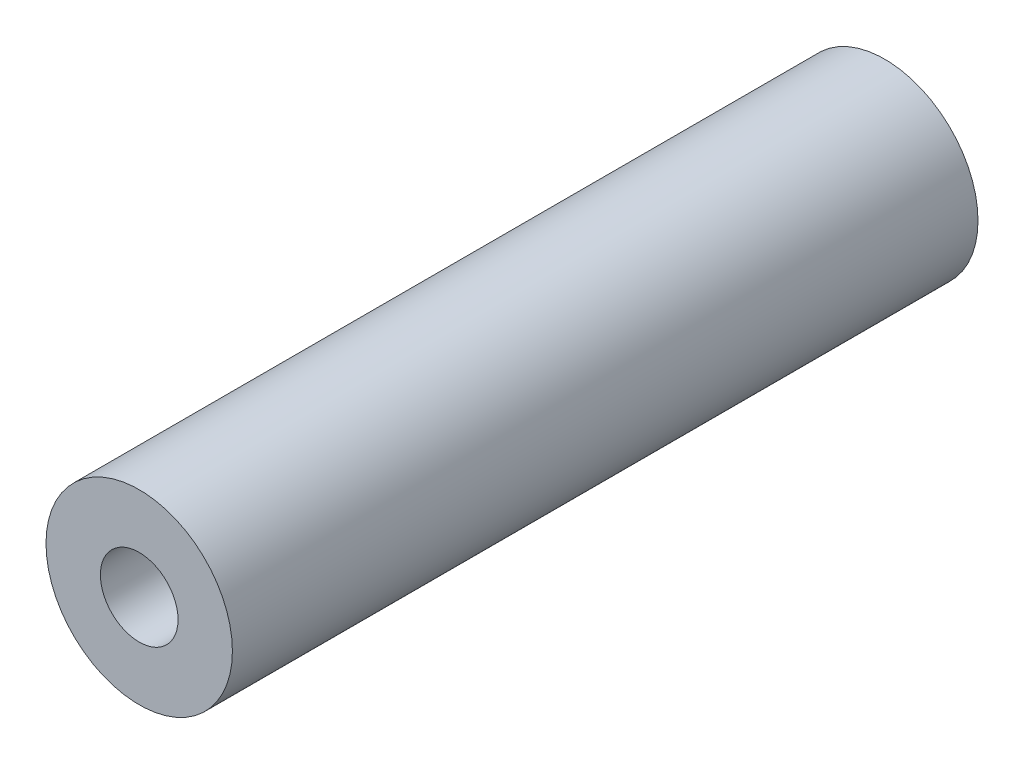
from build123d import *

# Parameters (mm, degrees)
SKETCH_1_R      = 3
SKETCH_1_R_2    = 1.25
EXTRUDE_1_DEPTH = 24


with BuildPart() as part:
    # ｽｹｯﾁ1 → ﾎﾞｽ - 押し出し1 (new body)
    with BuildSketch(Plane.XY):
        Circle(SKETCH_1_R)
        Circle(SKETCH_1_R_2, mode=Mode.SUBTRACT)
    extrude(amount=EXTRUDE_1_DEPTH)


solid = part.part
